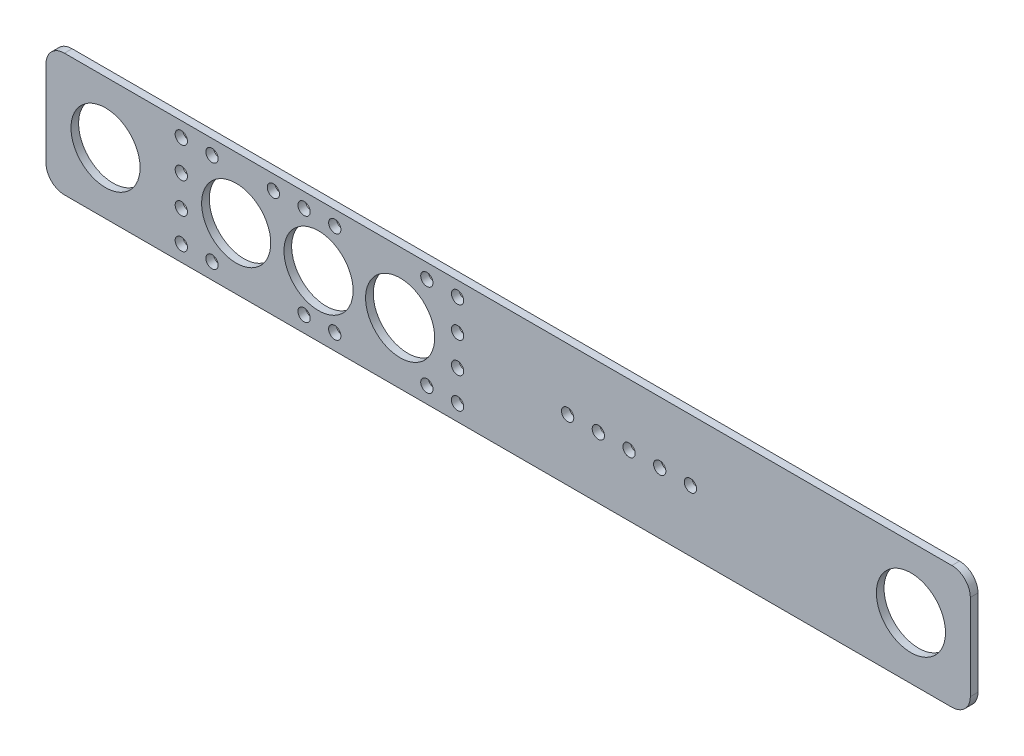
from build123d import *

# Parameters (mm, degrees)
SKETCH1_W           = 382.452818204
SKETCH1_H           = 50.8
SKETCH1_R           = 14.3002
SKETCH1_R_2         = 2.54
BOSS_EXTRUDE1_DEPTH = 3.175
FILLET1_R           = 7.62


with BuildPart() as part:
    # Sketch1 → Boss-Extrude1 (new body)
    with BuildSketch(Plane.XY):
        with Locations((132.2654537, 9.352736133)):
            Rectangle(SKETCH1_W, SKETCH1_H)
        with Locations((-34.334788468, 9.352736133)):
            Circle(SKETCH1_R, mode=Mode.SUBTRACT)
        with Locations((298.913211532, 9.352736133)):
            Circle(SKETCH1_R, mode=Mode.SUBTRACT)
        with Locations((53.803211532, 9.352736133)):
            Circle(SKETCH1_R, mode=Mode.SUBTRACT)
        with Locations((87.573397818, 9.352736133)):
            Circle(SKETCH1_R, mode=Mode.SUBTRACT)
        with Locations((19.729570927, 9.352736133)):
            Circle(SKETCH1_R, mode=Mode.SUBTRACT)
        with Locations((98.619809052, -9.430651268)):
            Circle(SKETCH1_R_2, mode=Mode.SUBTRACT)
        with Locations((111.319809052, -9.430651268)):
            Circle(SKETCH1_R_2, mode=Mode.SUBTRACT)
        with Locations((111.319809052, 3.269348732)):
            Circle(SKETCH1_R_2, mode=Mode.SUBTRACT)
        with Locations((111.319809052, 15.969348732)):
            Circle(SKETCH1_R_2, mode=Mode.SUBTRACT)
        with Locations((111.319809052, 28.669348732)):
            Circle(SKETCH1_R_2, mode=Mode.SUBTRACT)
        with Locations((98.619809052, 28.669348732)):
            Circle(SKETCH1_R_2, mode=Mode.SUBTRACT)
        with Locations((47.819809052, -9.430651268)):
            Circle(SKETCH1_R_2, mode=Mode.SUBTRACT)
        with Locations((60.519809052, -9.430651268)):
            Circle(SKETCH1_R_2, mode=Mode.SUBTRACT)
        with Locations((47.819809052, 28.669348732)):
            Circle(SKETCH1_R_2, mode=Mode.SUBTRACT)
        with Locations((60.519809052, 28.669348732)):
            Circle(SKETCH1_R_2, mode=Mode.SUBTRACT)
        with Locations((35.119809052, 28.669348732)):
            Circle(SKETCH1_R_2, mode=Mode.SUBTRACT)
        with Locations((9.719809052, -9.430651268)):
            Circle(SKETCH1_R_2, mode=Mode.SUBTRACT)
        with Locations((-2.980190948, -9.430651268)):
            Circle(SKETCH1_R_2, mode=Mode.SUBTRACT)
        with Locations((-2.980190948, 3.269348732)):
            Circle(SKETCH1_R_2, mode=Mode.SUBTRACT)
        with Locations((-2.980190948, 15.969348732)):
            Circle(SKETCH1_R_2, mode=Mode.SUBTRACT)
        with Locations((9.719809052, 28.669348732)):
            Circle(SKETCH1_R_2, mode=Mode.SUBTRACT)
        with Locations((-2.980190948, 28.669348732)):
            Circle(SKETCH1_R_2, mode=Mode.SUBTRACT)
        with Locations((156.877176863, 9.352736133)):
            Circle(SKETCH1_R_2, mode=Mode.SUBTRACT)
        with Locations((169.577176863, 9.352736133)):
            Circle(SKETCH1_R_2, mode=Mode.SUBTRACT)
        with Locations((182.277176863, 9.352736133)):
            Circle(SKETCH1_R_2, mode=Mode.SUBTRACT)
        with Locations((194.977176863, 9.352736133)):
            Circle(SKETCH1_R_2, mode=Mode.SUBTRACT)
        with Locations((207.677176863, 9.352736133)):
            Circle(SKETCH1_R_2, mode=Mode.SUBTRACT)
    extrude(amount=BOSS_EXTRUDE1_DEPTH)

    # Fillet1
    fillet1_edges = [part.edges().sort_by_distance(p)[0] for p in [
        (-58.960955402, 34.752736133, 1.5875),
        (323.491862802, 34.752736133, 1.5875),
        (323.491862802, -16.047263867, 1.5875),
        (-58.960955402, -16.047263867, 1.5875),
    ]]
    fillet(fillet1_edges, radius=FILLET1_R)


solid = part.part
